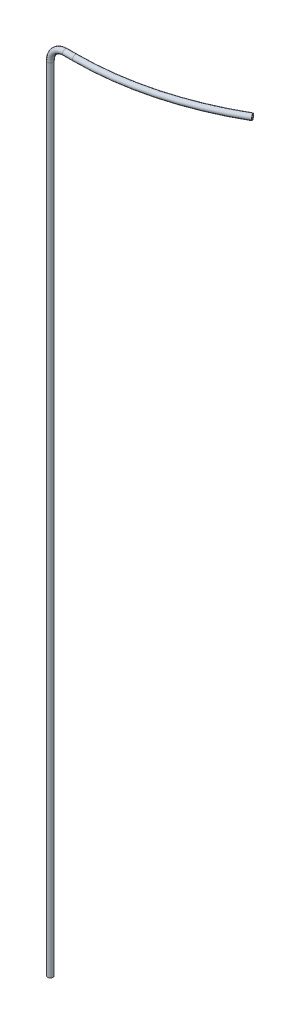
from build123d import *

# Parameters (mm, degrees)
SKETCH_1_R      = 6
SKETCH_1_R_2    = 4
REVOLVE_1_ANGLE = 30
SKETCH_2_R      = 15
SKETCH_2_R_2    = 10
SKETCH_2_R_3    = 6
SKETCH_2_R_4    = 4
SKETCH_11_R     = 6
SKETCH_11_R_2   = 4
EXTRUDE_1_DEPTH = 800


with BuildPart() as part:
    # 草图1 → 旋转1 (revolve)
    with BuildSketch(Plane(origin=(0, 0, 0), x_dir=(0, 0, -1), z_dir=(1, 0, 0))):
        with Locations((1300, -0.371055822)):
            Circle(SKETCH_1_R)
        with Locations((1300, -0.371055822)):
            Circle(SKETCH_1_R_2, mode=Mode.SUBTRACT)
    revolve(axis=Axis((0, 0, -1900), (0, 1, 0)), revolution_arc=REVOLVE_1_ANGLE)

    # 扫描1: sweep along a path in 草图3
    with BuildLine(Plane.YX.offset(500)) as sweep_1_path:
        Line((0, 0), (0, -21.341132523))
        ThreePointArc((0, -21.341132523), (-9.589995058, -44.493428655), (-32.742291189, -54.083423712))
        Line((-32.742291189, -54.083423712), (-932.742291189, -54.083423712))
    # 草图2 → 扫描1 (sweep)
    # profile 1 of 2: a face of its own
    with BuildSketch(Plane.ZY):
        with Locations((-500, -0.371055822)):
            Circle(SKETCH_2_R)
        with Locations((-500, -0.371055822)):
            Circle(SKETCH_2_R_2, mode=Mode.SUBTRACT)
    # profile 2 of 2: a face of its own
    with BuildSketch(Plane.ZY):
        with Locations((-1300, -0.371055822)):
            Circle(SKETCH_2_R_3)
        with Locations((-1300, -0.371055822)):
            Circle(SKETCH_2_R_4, mode=Mode.SUBTRACT)
    sweep(path=sweep_1_path.line)


with BuildPart() as sweep_1_kept_piece:
    # of the separate pieces the step leaves, the one the design keeps (sweep_1_pieces_kept)
    add(part.part.solids().sort_by_distance((0, -0.371055822, -1306))[0])

    # 草图11 → 凸台-拉伸1 (add)
    with BuildSketch(Plane.XZ.offset(932.742291189)):
        with Locations((-53.712367891, -1300)):
            Circle(SKETCH_11_R)
        with Locations((-53.712367891, -1300)):
            Circle(SKETCH_11_R_2, mode=Mode.SUBTRACT)
    extrude(amount=EXTRUDE_1_DEPTH)


solid = sweep_1_kept_piece.part
